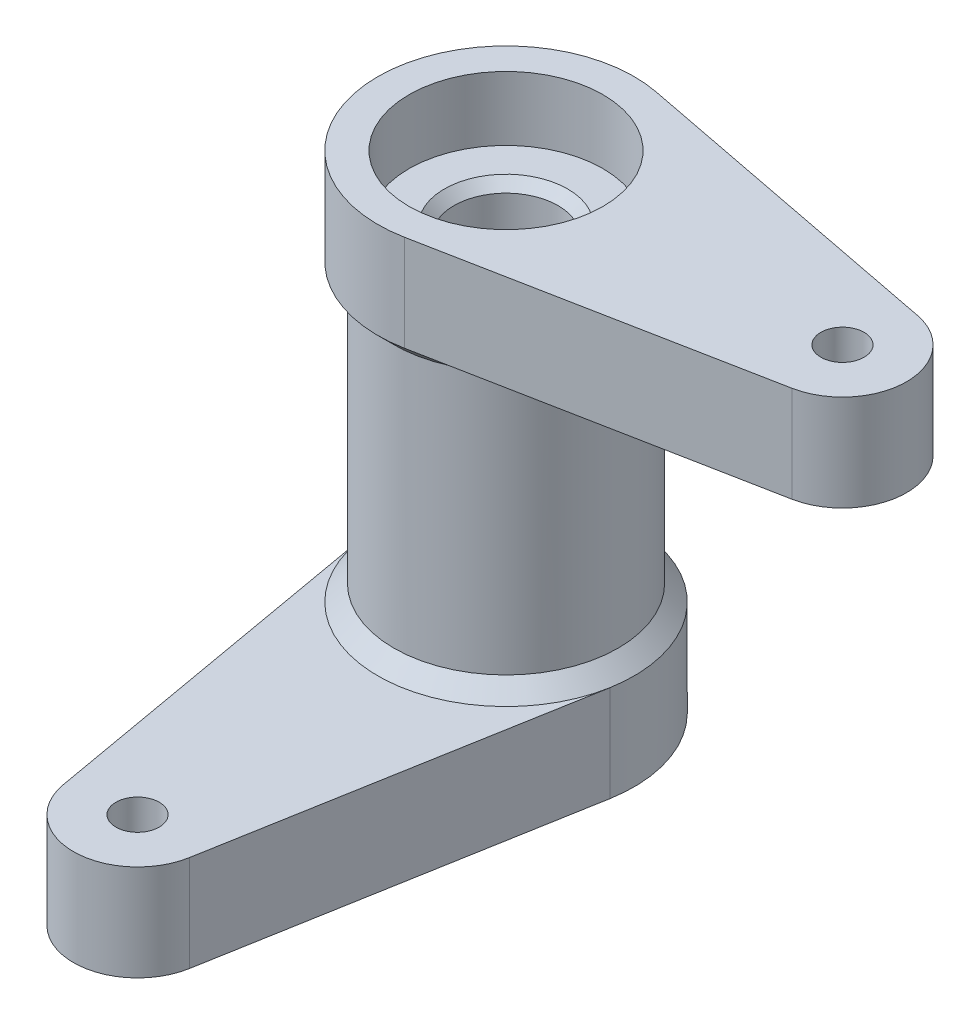
from build123d import *

# Parameters (mm, degrees)
ESQUISSE2_R             = 1.35
BOSS_EXTRU_2_DEPTH      = 6
BOSS_EXTRU_3_START      = -6
ESQUISSE3_R             = 1.35
BOSS_EXTRU_3_DEPTH      = 6
ENL_V_MAT_EXTRU_1_DEPTH = 3


with BuildPart() as part:
    # Esquisse1 → Révolution1 (revolve)
    with BuildSketch(Plane.XY, mode=Mode.PRIVATE) as r_volution1_sk:
        Polygon((-6.05, 0), (-6.05, 4), (-3.85, 4), (-3.25, 4.6), (-3.25, 25.8), (-3.85, 26.4), (-6.05, 26.4), (-6.05, 30.4), (-8, 30.4), (-8, 24.4), (-7, 23.4), (-7, 7), (-8, 6), (-8, 0), align=None)
    revolve(r_volution1_sk.sketch.rotate(Axis((0, 0, 0), (0, 1, 0)), 270), axis=Axis((0, 0, 0), (0, 1, 0)))

    # Esquisse2 → Boss.-Extru.2 (add)
    with BuildSketch(Plane(origin=(0, 0, 0), x_dir=(1, 0, 0), z_dir=(0, 1, 0))):
        with BuildLine():
            Line((-7.878088106, -1.391304348), (-3.939044053, -23.695652174))
            ThreePointArc((-3.939044053, -23.695652174), (0, -27), (3.939044053, -23.695652174))
            Line((3.939044053, -23.695652174), (7.878088106, -1.391304348))
            ThreePointArc((7.878088106, -1.391304348), (0, -8), (-7.878088106, -1.391304348))
        make_face()
        with Locations(Location((0, -23, 0), (0, 0, 90))):
            Circle(ESQUISSE2_R, mode=Mode.SUBTRACT)
    extrude(amount=BOSS_EXTRU_2_DEPTH)

    # Esquisse3 → Boss.-Extru.3 (add)
    with BuildSketch(Plane(origin=(0, 30.4, 0), x_dir=(1, 0, 0), z_dir=(0, 1, 0)).offset(BOSS_EXTRU_3_START)):
        with BuildLine():
            Line((21.761904762, 3.926767262), (1.523809524, 7.853534525))
            ThreePointArc((1.523809524, 7.853534525), (8, 0), (1.523809524, -7.853534525))
            Line((1.523809524, -7.853534525), (21.761904762, -3.926767262))
            ThreePointArc((21.761904762, -3.926767262), (25, 0), (21.761904762, 3.926767262))
        make_face()
        with Locations(Location((21, 0, 0), (0, 0, 270))):
            Circle(ESQUISSE3_R, mode=Mode.SUBTRACT)
    extrude(amount=BOSS_EXTRU_3_DEPTH)

    # Esquisse4 → Enlèv. mat.-Extru.1 (cut)
    with BuildSketch(Plane.XZ.offset(-24.4)):
        Polygon((21, -3.175426481), (23.75, -1.58771324), (23.75, 1.58771324), (21, 3.175426481), (18.25, 1.58771324), (18.25, -1.58771324), align=None)
    extrude(amount=-ENL_V_MAT_EXTRU_1_DEPTH, mode=Mode.SUBTRACT)


solid = part.part
